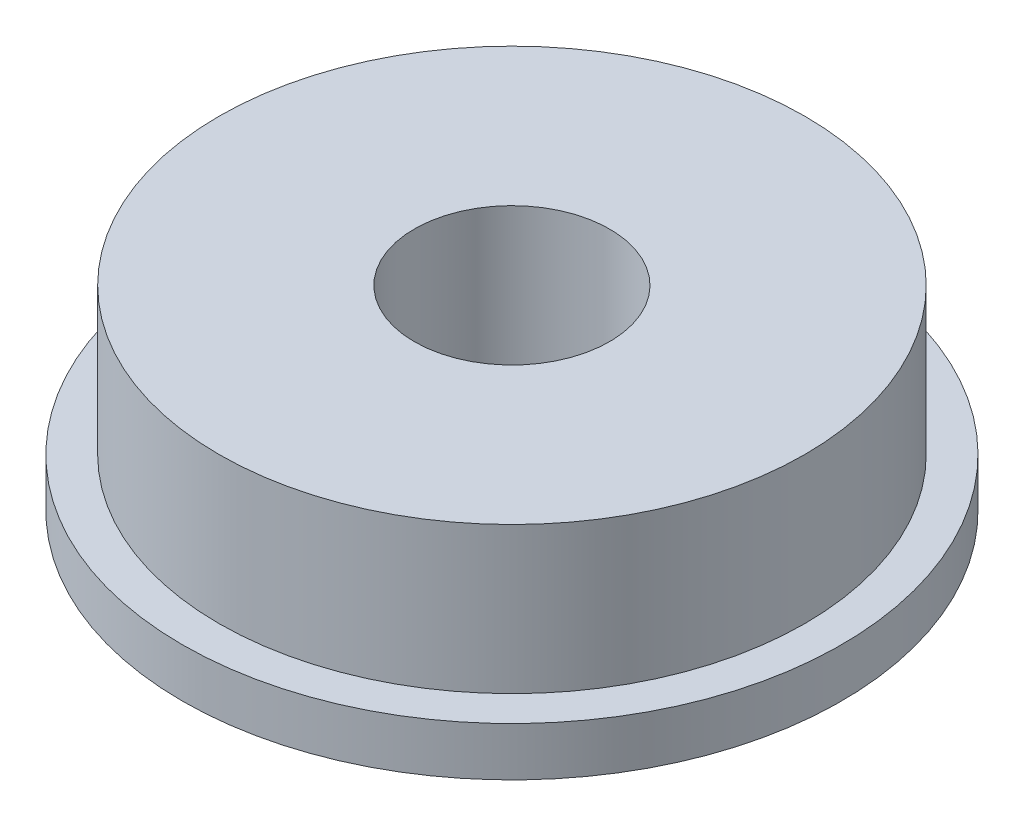
from build123d import *

# Parameters (mm, degrees)
SKETCH1_R           = 6
SKETCH1_R_2         = 2
BOSS_EXTRUDE1_DEPTH = 4
SKETCH1_3_R         = 6.75
SKETCH1_3_R_2       = 6
BOSS_EXTRUDE2_DEPTH = 1


with BuildPart() as part:
    # Sketch1 → Boss-Extrude1 (new body)
    with BuildSketch(Plane(origin=(0, 0, 0), x_dir=(1, 0, 0), z_dir=(0, 1, 0))):
        Circle(SKETCH1_R)
        Circle(SKETCH1_R_2, mode=Mode.SUBTRACT)
    extrude(amount=BOSS_EXTRUDE1_DEPTH)

    # Sketch1<3> → Boss-Extrude2 (add)
    with BuildSketch(Plane(origin=(0, 0, 0), x_dir=(1, 0, 0), z_dir=(0, 1, 0))):
        Circle(SKETCH1_3_R)
        Circle(SKETCH1_3_R_2, mode=Mode.SUBTRACT)
    extrude(amount=BOSS_EXTRUDE2_DEPTH)


solid = part.part
